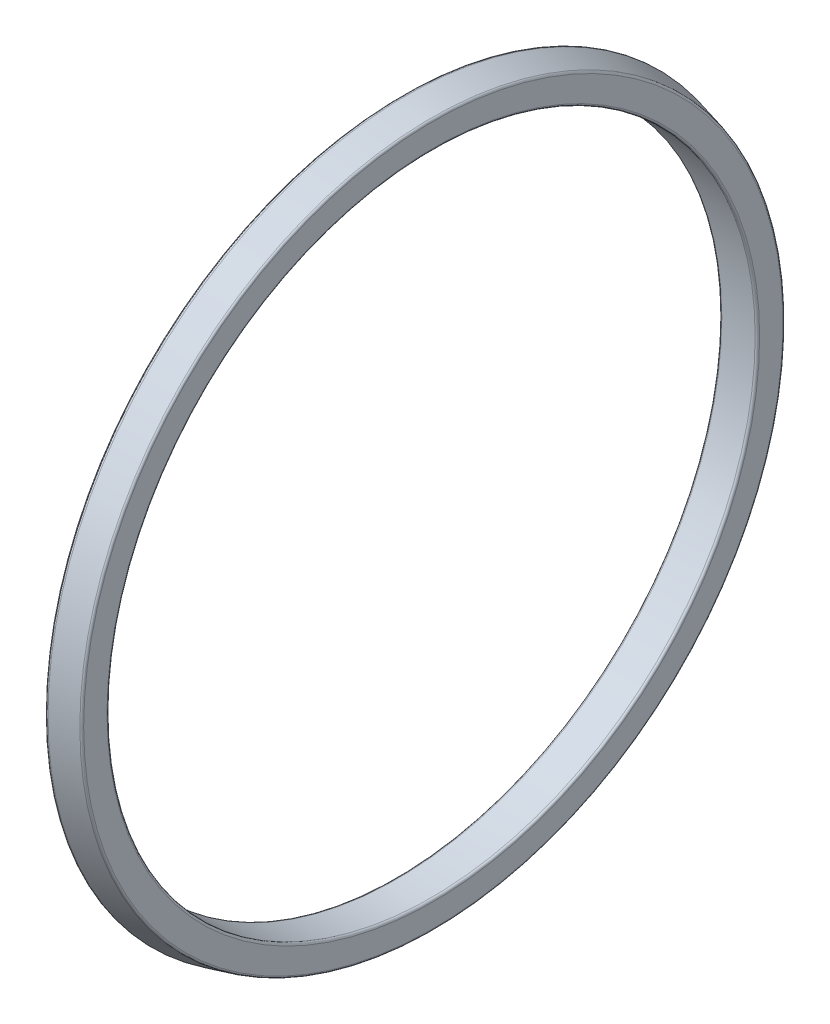
from build123d import *


with BuildPart() as part:
    # Croquis1 → Revolución1 (revolve)
    with BuildSketch(Plane(origin=(0, 0, 0), x_dir=(1, 0, 0), z_dir=(0, 1, 0)), mode=Mode.PRIVATE) as revoluci_n1_sk:
        with BuildLine():
            Line((0.55101533, 14.423831945), (2.033383193, 14.423831945))
            ThreePointArc((2.033383193, 14.423831945), (2.104093871, 14.453121267), (2.133383193, 14.523831945))
            Line((2.133383193, 14.523831945), (2.133383193, 15.560507297))
            ThreePointArc((2.133383193, 15.560507297), (2.11240351, 15.621791793), (2.058267403, 15.657361704))
            Line((2.058267403, 15.657361704), (0.929385167, 15.947398502))
            ThreePointArc((0.929385167, 15.947398502), (0.876975037, 15.9466811), (0.832127203, 15.919551629))
            Line((0.832127203, 15.919551629), (0.726301835, 15.808564047))
            ThreePointArc((0.726301835, 15.808564047), (0.699873329, 15.724125595), (0.750790376, 15.651766957))
            Line((0.750790376, 15.651766957), (1.369051357, 15.314533695))
            ThreePointArc((1.369051357, 15.314533695), (1.419231484, 15.207168922), (1.331676493, 15.127298008))
            Line((1.331676493, 15.127298008), (0.540504981, 15.043679986))
            ThreePointArc((0.540504981, 15.043679986), (0.476681505, 15.011125431), (0.45101533, 14.944233857))
            Line((0.45101533, 14.944233857), (0.45101533, 14.523831945))
            ThreePointArc((0.45101533, 14.523831945), (0.480304652, 14.453121267), (0.55101533, 14.423831945))
        make_face()
    revolve(revoluci_n1_sk.sketch.rotate(Axis((0, 0, 0), (1, 0, 0)), 180), axis=Axis((0, 0, 0), (1, 0, 0)))


solid = part.part
